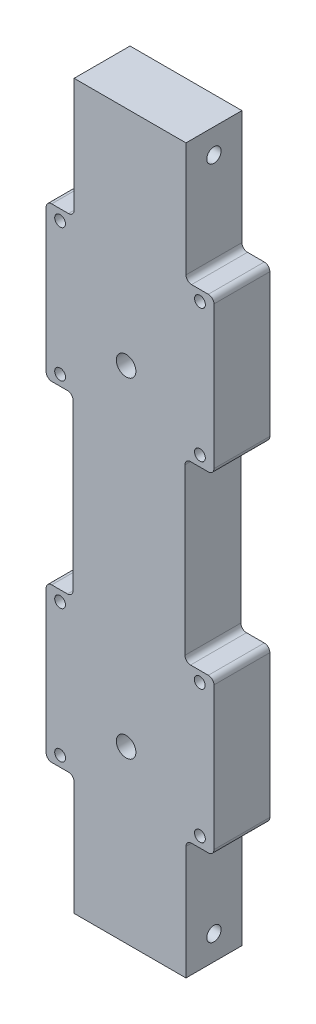
from build123d import *

# Parameters (mm, degrees)
SKETCH1_W                        = 69.85
SKETCH1_H                        = 76.2
SKETCH1_R                        = 4.445
BOSS_EXTRUDE1_DEPTH              = 25.4
SKETCH2_W                        = 50.8
SKETCH2_H                        = 49.911
CUT_EXTRUDE1_DEPTH               = 15.875
SKETCH4_W                        = 50.8
SKETCH4_H                        = 25.4
BOSS_EXTRUDE2_DEPTH              = 79.9846
SKETCH7_W                        = 76.2
SKETCH7_H                        = 25.4
BOSS_EXTRUDE5_DEPTH              = 69.85
SKETCH10_R                       = 4.445
CUT_EXTRUDE3_DEPTH               = 191.349362468
SKETCH11_W                       = 50.8
SKETCH11_H                       = 49.911
CUT_EXTRUDE4_DEPTH               = 15.875
SKETCH12_W                       = 50.8
SKETCH12_H                       = 25.4
BOSS_EXTRUDE7_DEPTH              = 54.4576
SKETCH13_W                       = 50.8
SKETCH13_H                       = 25.4
BOSS_EXTRUDE8_DEPTH              = 54.2798
F_10_0_1935_DIAMETER_HOLE2_D     = 4.9149
F_10_0_1935_DIAMETER_HOLE2_DEPTH = 11.938
F_10_0_1935_DIAMETER_HOLE2_TIP   = 1.476584928
SKETCH18_R                       = 3.2639
CUT_EXTRUDE5_DEPTH               = 12.7
CUT_EXTRUDE6_START               = -12.7
SKETCH19_R                       = 3.2639
CUT_EXTRUDE6_DEPTH               = 12.7
SKETCH20_R                       = 3.2639
CUT_EXTRUDE7_DEPTH               = 12.7
CUT_EXTRUDE8_START               = -12.7
SKETCH21_R                       = 3.2639
CUT_EXTRUDE8_DEPTH               = 12.7
F_10_0_1935_DIAMETER_HOLE3_D     = 4.9149
F_10_0_1935_DIAMETER_HOLE3_DEPTH = 11.938
F_10_0_1935_DIAMETER_HOLE3_TIP   = 1.476584928
FILLET1_R                        = 2.54
FILLET2_R                        = 2.54


with BuildPart() as part:
    # Sketch1 → Boss-Extrude1 (new body)
    with BuildSketch(Plane(origin=(0, 0, 0), x_dir=(0, 1, 0), z_dir=(0, 0, 1))):
        Rectangle(SKETCH1_W, SKETCH1_H)
        with Locations(Location((-11.811, 1.778, 0), (0, 0, 270))):
            Circle(SKETCH1_R, mode=Mode.SUBTRACT)
    extrude(amount=BOSS_EXTRUDE1_DEPTH)

    # Sketch2 → Cut-Extrude1 (cut)
    with BuildSketch(Plane(origin=(0, 0, 0), x_dir=(1, 0, 0), z_dir=(0, 0, -1))):
        with Locations((0, 2.7305)):
            Rectangle(SKETCH2_W, SKETCH2_H)
    extrude(amount=-CUT_EXTRUDE1_DEPTH, mode=Mode.SUBTRACT)

    # Sketch4 → Boss-Extrude2 (add)
    with BuildSketch(Plane(origin=(0, 34.925, 0), x_dir=(-1, 0, 0), z_dir=(0, 1, 0))):
        with Locations((0.465931196, 12.7)):
            Rectangle(SKETCH4_W, SKETCH4_H)
    extrude(amount=BOSS_EXTRUDE2_DEPTH)

    # Sketch7 → Boss-Extrude5 (add)
    with BuildSketch(Plane(origin=(0, 114.9096, 0), x_dir=(-1, 0, 0), z_dir=(0, 1, 0))):
        with Locations((0, 12.7)):
            Rectangle(SKETCH7_W, SKETCH7_H)
    extrude(amount=BOSS_EXTRUDE5_DEPTH)

    # Sketch10 → Cut-Extrude3 (cut, through all)
    with BuildSketch(Plane.XY.offset(25.4)):
        with Locations((-1.778, 138.0236)):
            Circle(SKETCH10_R)
    extrude(amount=-CUT_EXTRUDE3_DEPTH, mode=Mode.SUBTRACT)

    # Sketch11 → Cut-Extrude4 (cut)
    with BuildSketch(Plane(origin=(0, 0, 0), x_dir=(1, 0, 0), z_dir=(0, 0, -1))):
        with Locations((0, -147.1041)):
            Rectangle(SKETCH11_W, SKETCH11_H)
    extrude(amount=-CUT_EXTRUDE4_DEPTH, mode=Mode.SUBTRACT)

    # Sketch12 → Boss-Extrude7 (add)
    with BuildSketch(Plane(origin=(0, 184.7596, 0), x_dir=(-1, 0, 0), z_dir=(0, 1, 0))):
        with Locations((0, 12.7)):
            Rectangle(SKETCH12_W, SKETCH12_H)
    extrude(amount=BOSS_EXTRUDE7_DEPTH)

    # Sketch13 → Boss-Extrude8 (add)
    with BuildSketch(Plane.XZ.offset(34.925)):
        with Locations((0, 12.7)):
            Rectangle(SKETCH13_W, SKETCH13_H)
    extrude(amount=BOSS_EXTRUDE8_DEPTH)

    # #10 (0.1935) Diameter Hole2
    with Locations(Plane.XY.offset(25.4)):
        with Locations((31.75, 119.6721), (31.75, 179.9971), (-31.75, 179.9971), (-31.75, 119.6721)):
            Hole(F_10_0_1935_DIAMETER_HOLE2_D / 2, depth=F_10_0_1935_DIAMETER_HOLE2_DEPTH)
            with Locations((0, 0, -(F_10_0_1935_DIAMETER_HOLE2_DEPTH + F_10_0_1935_DIAMETER_HOLE2_TIP / 2))):  # 118° drill point
                Cone(0, F_10_0_1935_DIAMETER_HOLE2_D / 2, F_10_0_1935_DIAMETER_HOLE2_TIP, mode=Mode.SUBTRACT)

    # Sketch18 → Cut-Extrude5 (cut)
    with BuildSketch(Plane.YZ.offset(25.4)):
        with Locations(Location((228.1047, 12.7, 0), (0, 0, 270))):
            Circle(SKETCH18_R)
    extrude(amount=-CUT_EXTRUDE5_DEPTH, mode=Mode.SUBTRACT)

    # Sketch19 → Cut-Extrude6 (cut)
    with BuildSketch(Plane(origin=(-25.4, 0, 0), x_dir=(0, -1, 0), z_dir=(-1, 0, 0)).offset(CUT_EXTRUDE6_START)):
        with Locations(Location((-228.1047, 12.7, 0), (0, 0, 270))):
            Circle(SKETCH19_R)
    extrude(amount=CUT_EXTRUDE6_DEPTH, mode=Mode.SUBTRACT)

    # Sketch20 → Cut-Extrude7 (cut)
    with BuildSketch(Plane(origin=(-25.4, 0, 0), x_dir=(0, -1, 0), z_dir=(-1, 0, 0))):
        with Locations(Location((78.0923, 12.7, 0), (0, 0, 90))):
            Circle(SKETCH20_R)
    extrude(amount=-CUT_EXTRUDE7_DEPTH, mode=Mode.SUBTRACT)

    # Sketch21 → Cut-Extrude8 (cut)
    with BuildSketch(Plane.YZ.offset(25.4).offset(CUT_EXTRUDE8_START)):
        with Locations(Location((-78.0923, 12.7, 0), (0, 0, 90))):
            Circle(SKETCH21_R)
    extrude(amount=CUT_EXTRUDE8_DEPTH, mode=Mode.SUBTRACT)

    # #10 (0.1935) Diameter Hole3
    with Locations(Plane.XY.offset(25.4)):
        with Locations((31.75, -30.1625), (31.663484949, 30.1625), (-31.75, 30.1625), (-31.75, -30.1625)):
            Hole(F_10_0_1935_DIAMETER_HOLE3_D / 2, depth=F_10_0_1935_DIAMETER_HOLE3_DEPTH)
            with Locations((0, 0, -(F_10_0_1935_DIAMETER_HOLE3_DEPTH + F_10_0_1935_DIAMETER_HOLE3_TIP / 2))):  # 118° drill point
                Cone(0, F_10_0_1935_DIAMETER_HOLE3_D / 2, F_10_0_1935_DIAMETER_HOLE3_TIP, mode=Mode.SUBTRACT)

    # Fillet1
    fillet1_edges = [part.edges().sort_by_distance(p)[0] for p in [
        (-25.4, -34.925, 12.7),
        (25.4, -34.925, 12.7),
        (24.934068804, 34.925, 12.7),
        (-25.865931196, 34.925, 12.7),
        (24.934068804, 114.9096, 12.7),
        (-25.865931196, 114.9096, 12.7),
        (38.1, 114.9096, 12.7),
        (-38.1, 114.9096, 12.7),
        (38.1, 184.7596, 12.7),
        (-38.1, 184.7596, 12.7),
        (38.1, 34.925, 12.7),
        (38.1, -34.925, 12.7),
        (-38.1, -34.925, 12.7),
        (-38.1, 34.925, 12.7),
        (25.4, 184.7596, 12.7),
        (-25.4, 184.7596, 12.7),
    ]]
    fillet(fillet1_edges, radius=FILLET1_R)

    # Fillet2
    fillet2_edges = [part.edges().sort_by_distance(p)[0] for p in [
        (-25.4, -2.7305, 15.875),
        (0, -27.686, 15.875),
        (25.4, -2.7305, 15.875),
        (0, 22.225, 15.875),
        (-25.4, 147.1041, 15.875),
        (0, 122.1486, 15.875),
        (25.4, 147.1041, 15.875),
        (0, 172.0596, 15.875),
    ]]
    fillet(fillet2_edges, radius=FILLET2_R)


solid = part.part
